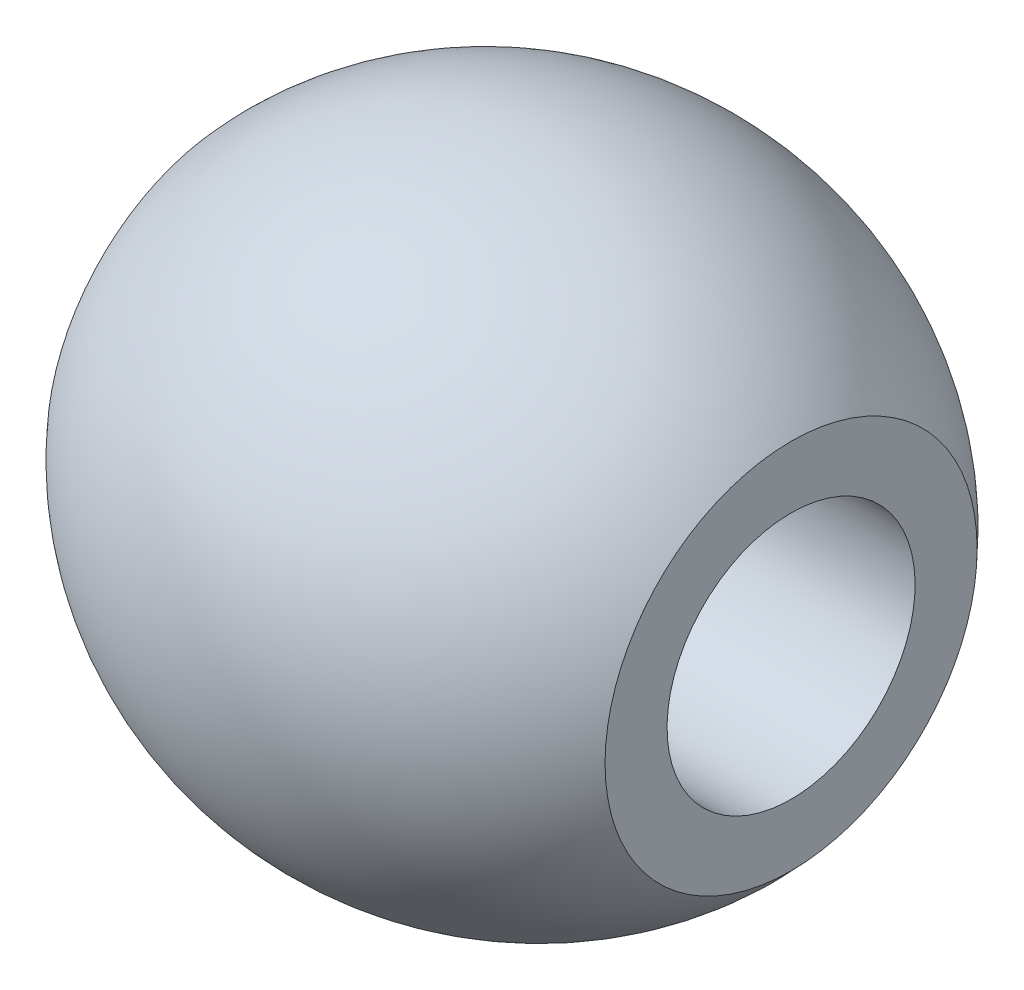
from build123d import *


with BuildPart() as part:
    # Sketch1 → Revolve2 (revolve)
    with BuildSketch(Plane.XY, mode=Mode.PRIVATE) as revolve2_sk:
        with BuildLine():
            Line((-5, 0), (4, 0))
            Line((4, 0), (4, 3))
            ThreePointArc((4, 3), (-0.5, 5.031373033), (-5, 3))
            Line((-5, 3), (-5, 0))
        make_face()
    revolve(revolve2_sk.sketch.rotate(Axis((-5, 0, 0), (1, 0, 0)), 180), axis=Axis((-5, 0, 0), (1, 0, 0)))

    # Sketch2 → Cut-Revolve1 (revolve, cut)
    with BuildSketch(Plane.XY):
        Polygon((-5, 3), (-4, 2), (4, 2), (4, 0), (-5, 0), align=None)
    revolve(axis=Axis((4, 0, 0), (-1, 0, 0)), mode=Mode.SUBTRACT)


solid = part.part
